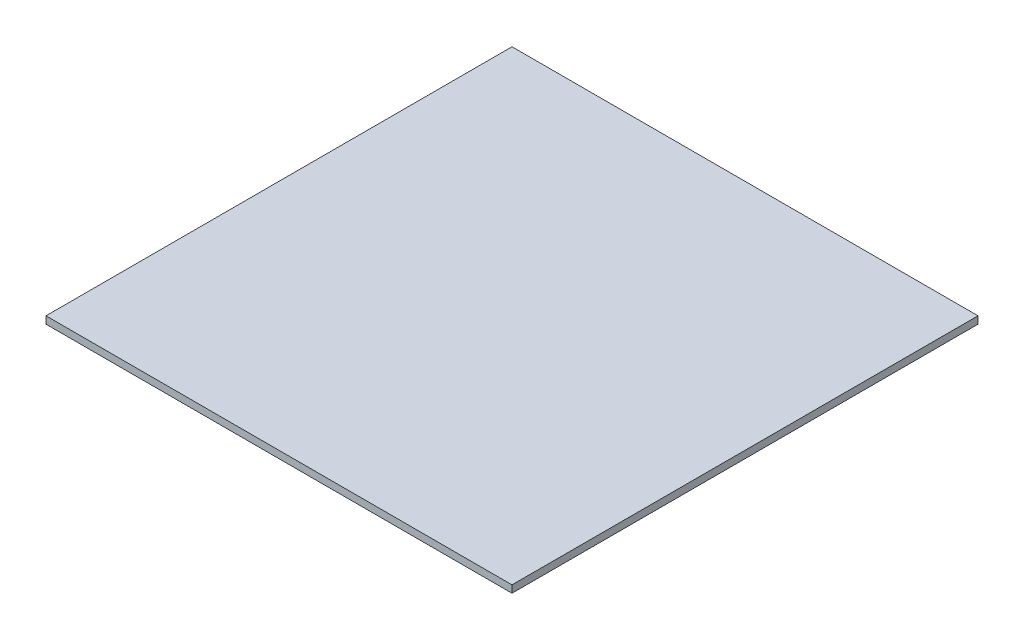
from build123d import *

# Parameters (mm, degrees)
SKETCH1_W           = 203.2
SKETCH1_H           = 203.2
BOSS_EXTRUDE1_DEPTH = 3.175


with BuildPart() as part:
    # Sketch1 → Boss-Extrude1 (new body)
    with BuildSketch(Plane(origin=(0, 0, 0), x_dir=(1, 0, 0), z_dir=(0, 1, 0))):
        with Locations((101.6, 101.6)):
            Rectangle(SKETCH1_W, SKETCH1_H)
    extrude(amount=BOSS_EXTRUDE1_DEPTH)


solid = part.part
